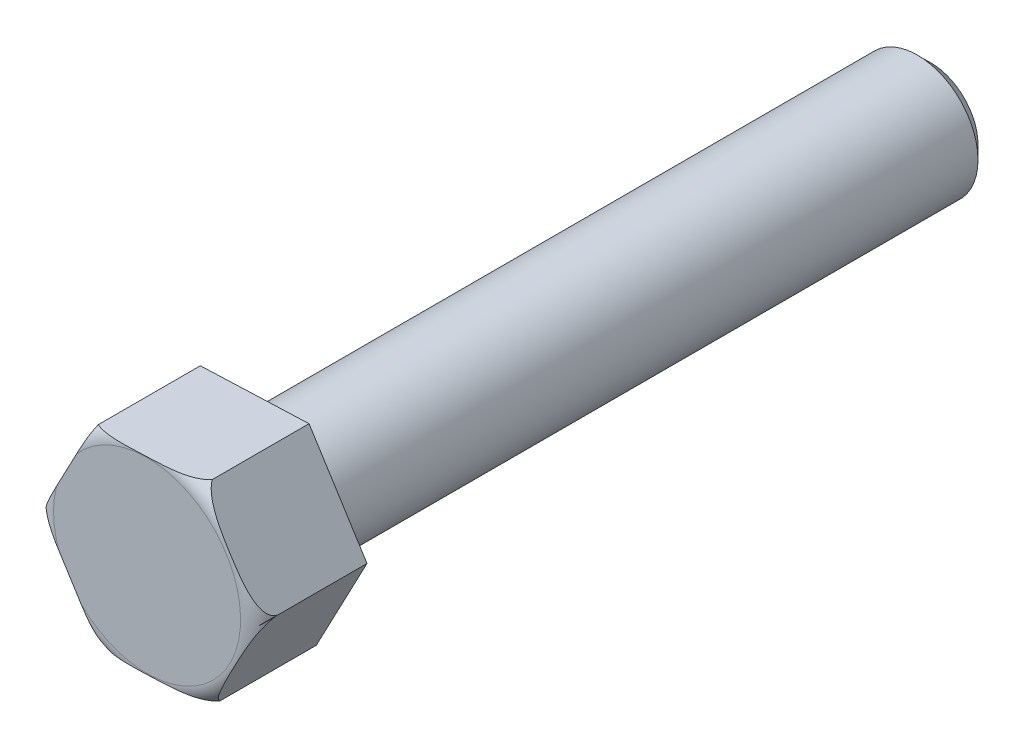
from build123d import *

# Parameters (mm, degrees)
SKETCH1_R           = 2.25
BOSS_EXTRUDE1_DEPTH = 25
BOSS_EXTRUDE2_DEPTH = 4
CHAMFER1_SIZE       = 0.5


with BuildPart() as part:
    # Sketch1 → Boss-Extrude1 (new body)
    with BuildSketch(Plane.XY):
        Circle(SKETCH1_R)
    extrude(amount=BOSS_EXTRUDE1_DEPTH)

    # Sketch2 → Boss-Extrude2 (add)
    with BuildSketch(Plane.XY.offset(25)):
        Polygon((1.886184201, 3.57767771), (-2.155267683, 3.42232229), (-4.041451884, -0.15535542), (-1.886184201, -3.57767771), (2.155267683, -3.42232229), (4.041451884, 0.15535542), align=None)
    extrude(amount=BOSS_EXTRUDE2_DEPTH)

    # Sketch4 → Cut-Revolve1 (revolve, cut)
    with BuildSketch(Plane(origin=(0, 0, 0), x_dir=(1, 0, 0), z_dir=(0, 1, 0))):
        with BuildLine():
            Line((4.041451884, -28.3), (4.041451884, -29))
            Line((4.041451884, -29), (3.341451884, -29))
            ThreePointArc((3.341451884, -29), (3.836426631, -28.794974747), (4.041451884, -28.3))
        make_face()
    revolve(axis=Axis((-0.134541741, 0, 29), (0, 0, -1)), mode=Mode.SUBTRACT)

    # Chamfer1
    chamfer1_edges = [part.edges().sort_by_distance(p)[0] for p in [
        (-2.25, 0, 0),
    ]]
    chamfer(chamfer1_edges, length=CHAMFER1_SIZE)


solid = part.part
